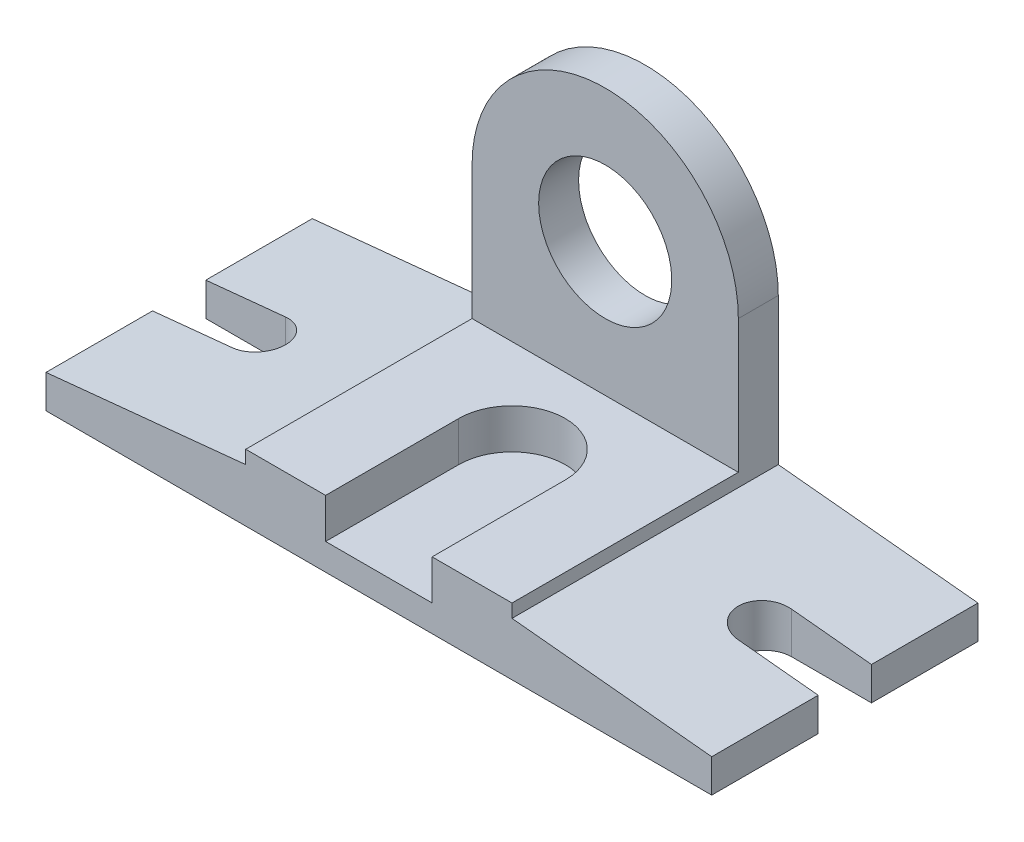
from build123d import *

# Parameters (mm, degrees)
BOSS_EXTRUDE1_DEPTH = 200
CUT_EXTRUDE1_DEPTH  = 30
CUT_EXTRUDE2_DEPTH  = 325.03703492
SKETCH5_R           = 50
BOSS_EXTRUDE2_DEPTH = 30


with BuildPart() as part:
    # Sketch2 → Boss-Extrude1 (new body)
    with BuildSketch(Plane.XY):
        Polygon((-250, 0), (250, 0), (250, 25), (100, 40), (100, 50), (-100, 50), (-100, 40), (-250, 25), align=None)
    extrude(amount=-BOSS_EXTRUDE1_DEPTH)

    # Sketch3 → Cut-Extrude1 (cut)
    with BuildSketch(Plane(origin=(0, 50, 0), x_dir=(1, 0, 0), z_dir=(0, 1, 0))):
        with BuildLine():
            Line((-40, 100), (-40, 0))
            Line((-40, 0), (40, 0))
            Line((40, 0), (40, 100))
            ThreePointArc((40, 100), (0, 140), (-40, 100))
        make_face()
    extrude(amount=-CUT_EXTRUDE1_DEPTH, mode=Mode.SUBTRACT)

    # Sketch4 → Cut-Extrude2 (cut, through all)
    with BuildSketch(Plane.XZ):
        with BuildLine():
            Line((-190, -80), (-250, -80))
            Line((-250, -80), (-250, -120))
            Line((-250, -120), (-190, -120))
            ThreePointArc((-190, -120), (-170, -100), (-190, -80))
        make_face()
        with BuildLine():
            Line((250, -120), (250, -80))
            Line((250, -80), (190, -80))
            ThreePointArc((190, -80), (170, -100), (190, -120))
            Line((190, -120), (250, -120))
        make_face()
    extrude(amount=-CUT_EXTRUDE2_DEPTH, mode=Mode.SUBTRACT)

    # Sketch5 → Boss-Extrude2 (add)
    with BuildSketch(Plane(origin=(0, 0, -200), x_dir=(-1, 0, 0), z_dir=(0, 0, -1))):
        with BuildLine():
            Line((-100, 50), (-100, 150))
            ThreePointArc((-100, 150), (0, 250), (100, 150))
            Line((100, 150), (100, 50))
            Line((100, 50), (-100, 50))
        make_face()
        with Locations((0, 150)):
            Circle(SKETCH5_R, mode=Mode.SUBTRACT)
    extrude(amount=-BOSS_EXTRUDE2_DEPTH)


solid = part.part
